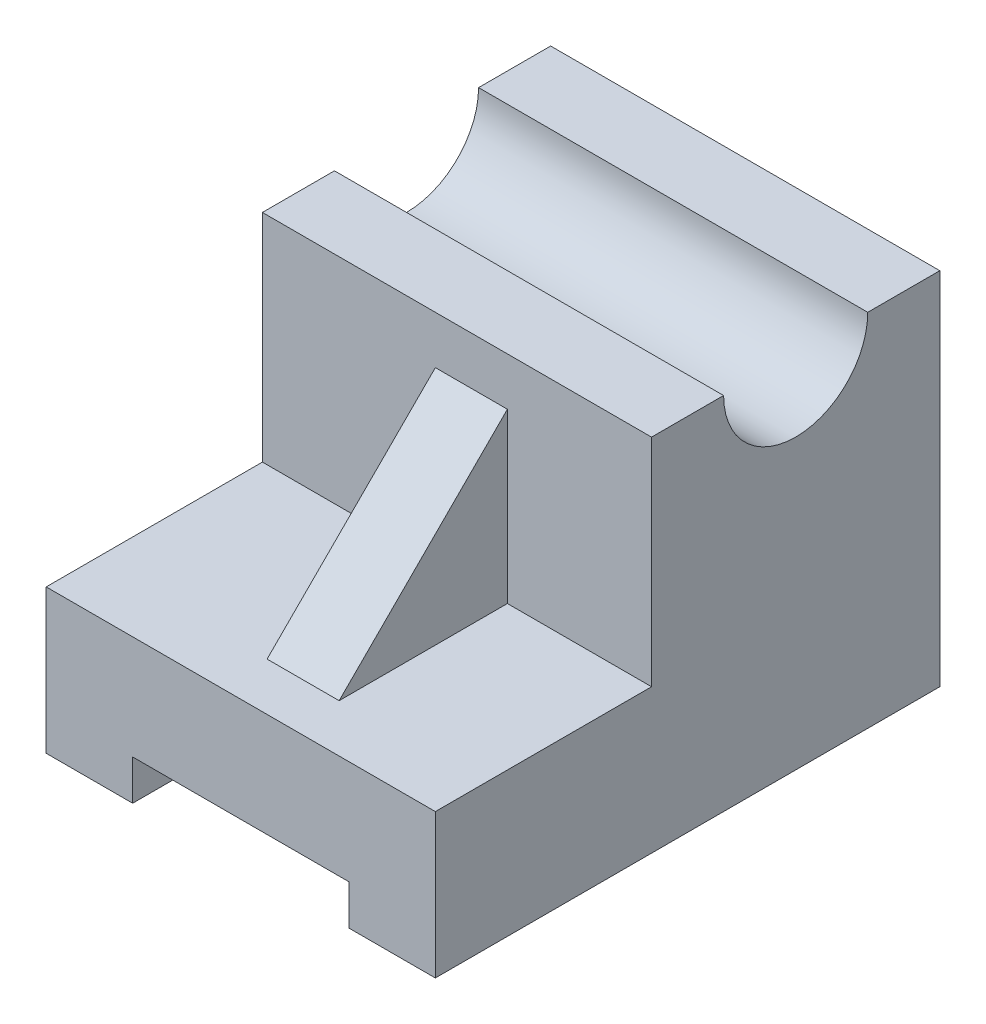
from build123d import *

# Parameters (mm, degrees)
BOSS_EXTRUDE1_DEPTH = 54
SKETCH2_R           = 10
CUT_EXTRUDE1_DEPTH  = 84.555784218
RIB4_REACH          = 74.26
SKETCH5_WALL_W      = 188.871183906
SKETCH5_WALL_H      = 10
SKETCH6_W           = 30
SKETCH6_H           = 11.131491479
CUT_EXTRUDE2_DEPTH  = 101.562854881


with BuildPart() as part:
    # Sketch1 → Boss-Extrude1 (new body)
    with BuildSketch(Plane(origin=(0, 0, 0), x_dir=(0, 0, -1), z_dir=(1, 0, 0))):
        Polygon((42.055692771, 47.925857131), (2.055692771, 47.925857131), (2.055692771, 17.925857131), (-27.944307229, 17.925857131), (-27.944307229, -2.074142869), (42.055692771, -2.074142869), align=None)
    extrude(amount=BOSS_EXTRUDE1_DEPTH)

    # Sketch2 → Cut-Extrude1 (cut, through all)
    with BuildSketch(Plane(origin=(54, 0, 0), x_dir=(0, 0, -1), z_dir=(1, 0, 0))):
        with Locations((22.055692771, 47.925857131)):
            Circle(SKETCH2_R)
    extrude(amount=-CUT_EXTRUDE1_DEPTH, mode=Mode.SUBTRACT)

    # Sketch5 wall → Rib4 (add, up to next)
    with BuildSketch(Plane(origin=(34, 28.80129121, 10.41851211), x_dir=(0, -0.707106781187, 0.707106781187), z_dir=(0, -0.707106781187, -0.707106781187)), mode=Mode.PRIVATE) as rib4_sk1:
        with Locations((0, 5)):
            Rectangle(SKETCH5_WALL_W, SKETCH5_WALL_H)
    rib4_tool1 = extrude(rib4_sk1.sketch, amount=RIB4_REACH, mode=Mode.PRIVATE) - part.part
    add(rib4_tool1.solids().sort_by_distance((34, 28.80129121, 10.41851211))[0])

    # Sketch6 → Cut-Extrude2 (cut, through all)
    with BuildSketch(Plane.XY.offset(27.944307229)):
        with Locations((27, -2.074142869)):
            Rectangle(SKETCH6_W, SKETCH6_H)
    extrude(amount=-CUT_EXTRUDE2_DEPTH, mode=Mode.SUBTRACT)


solid = part.part
